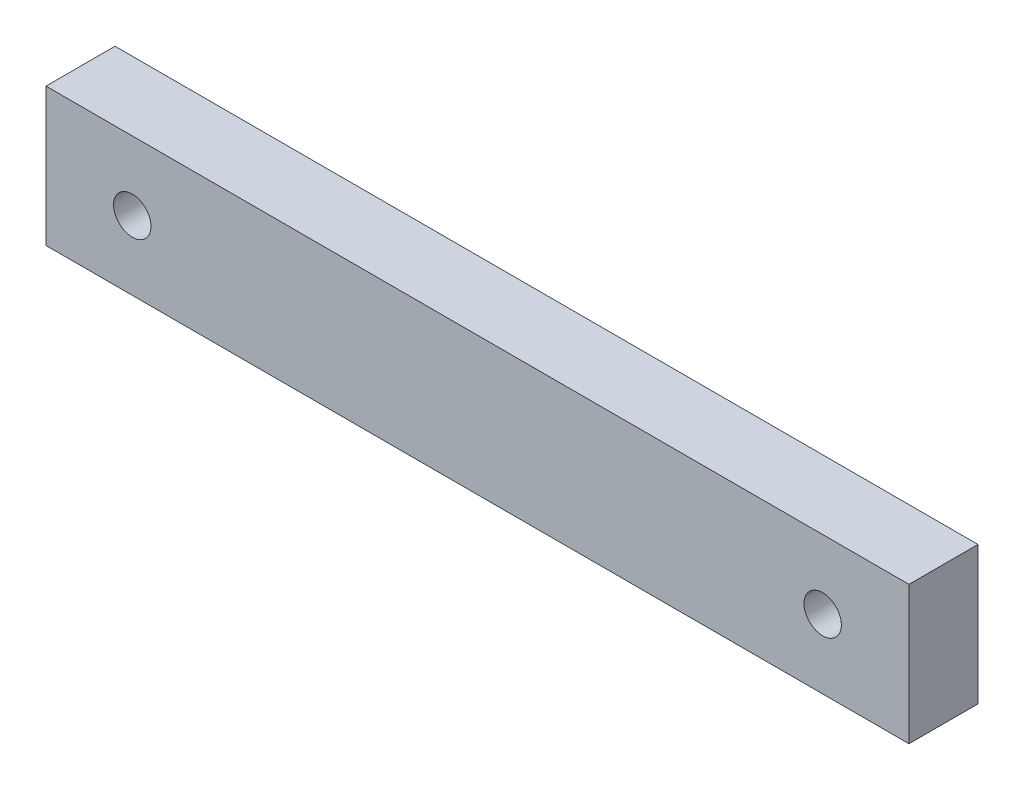
from build123d import *

# Parameters (mm, degrees)
SKETCH2_W               = 150
SKETCH2_H               = 24
BOSS_EXTRUDE1_DEPTH     = 6
CUT_EXTRUDE1_DEPTH      = 77.896033708
CUT_EXTRUDE1_DEPTH_BACK = 77.896033708
SKETCH3_R               = 3.25


with BuildPart() as part:
    # Sketch2 → Boss-Extrude1 (new, symmetric)
    with BuildSketch(Plane.XY):
        Rectangle(SKETCH2_W, SKETCH2_H)
    extrude(amount=BOSS_EXTRUDE1_DEPTH, both=True)

    # Sketch3 → Cut-Extrude1 (cut, two sides: drawn at the far end of the back side and taken through both)
    with BuildSketch(Plane.XY.offset(6).offset(-CUT_EXTRUDE1_DEPTH_BACK)):
        with Locations((-60, 0)):
            Circle(SKETCH3_R)
        with Locations((60, 0)):
            Circle(SKETCH3_R)
    extrude(amount=CUT_EXTRUDE1_DEPTH + CUT_EXTRUDE1_DEPTH_BACK, mode=Mode.SUBTRACT)


solid = part.part
